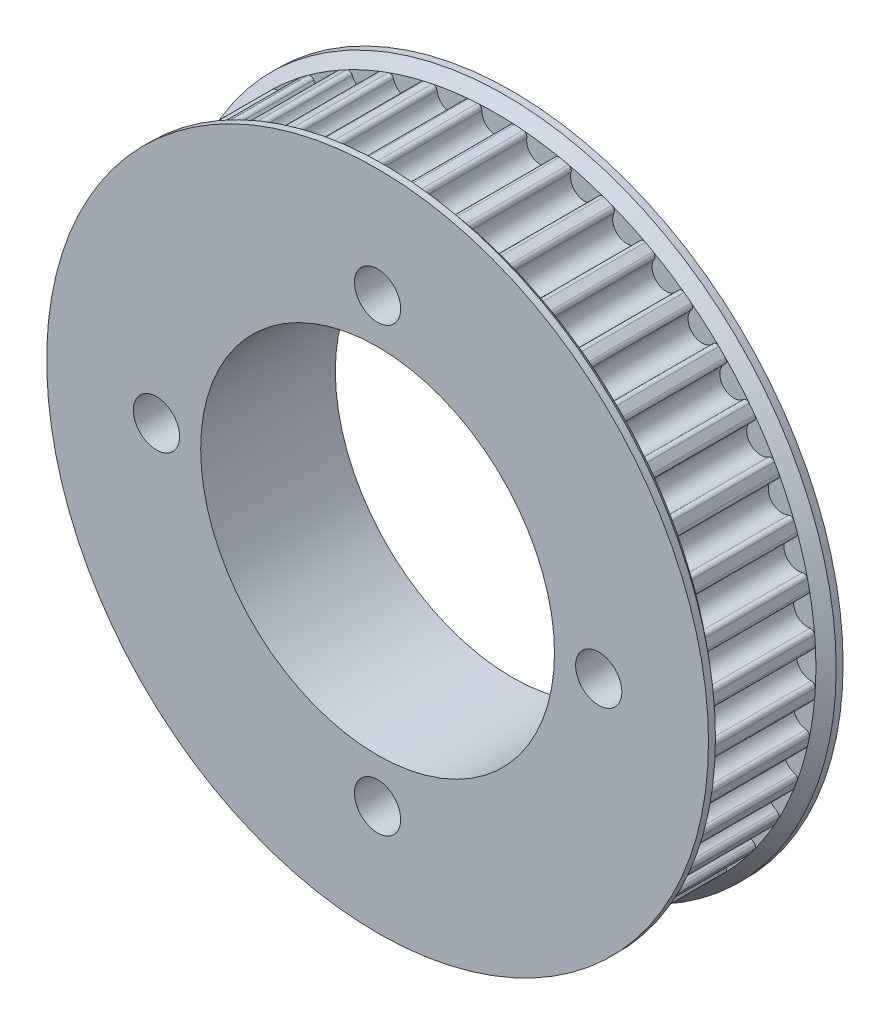
from build123d import *

# Parameters (mm, degrees)
CROQUIS2_R                 = 34.44258748
SALIENTE_EXTRUIR1_DEPTH    = 5.5
CORTAR_EXTRUIR2_DEPTH      = 50.018707293
MATRIZC4_COUNT             = 44
CORTAR_EXTRUIR3_DEPTH      = 51.913407148
CORTAR_EXTRUIR3_DEPTH_BACK = 51.913407148
CROQUIS7_R                 = 19.05
CROQUIS7_R_2               = 2.4892
CORTAR_EXTRUIR4_DEPTH      = 14.5


with BuildPart() as part:
    # Croquis2 → Saliente-Extruir1 (new, symmetric)
    with BuildSketch(Plane.XY):
        Circle(CROQUIS2_R)
    extrude(amount=SALIENTE_EXTRUIR1_DEPTH, both=True)

    # Croquis4 → Cortar-Extruir2 (cut, symmetric)
    with BuildSketch(Plane.XY):
        with BuildLine():
            ThreePointArc((-1.97909891, 34.385680157), (0, 34.44258748), (1.97909891, 34.385680157))
            ThreePointArc((1.97909891, 34.385680157), (1.655319797, 34.265351065), (1.524524764, 33.945656425))
            ThreePointArc((1.524524764, 33.945656425), (0, 32.38258748), (-1.524524764, 33.945656425))
            ThreePointArc((-1.524524764, 33.945656425), (-1.655319797, 34.265351065), (-1.97909891, 34.385680157))
        make_face()
    cortar_extruir2 = extrude(amount=CORTAR_EXTRUIR2_DEPTH, both=True, mode=Mode.SUBTRACT)

    # MatrizC4: Cortar-Extruir2 ×44 about axis
    matrizc4_axis = Axis((0, 0, 0), (0, 0, 1))
    for i in range(1, MATRIZC4_COUNT):
        add(cortar_extruir2.rotate(matrizc4_axis, i * 360 / MATRIZC4_COUNT), mode=Mode.SUBTRACT)

    # Croquis5 → Revolución1 (revolve)
    with BuildSketch(Plane(origin=(0, 0, 0), x_dir=(1, 0, 0), z_dir=(0, 1, 0))):
        Polygon((0, 5.5), (34.44258748, 5.5), (35.634341073, 6.5), (35.634341073, 7.25), (0, 7.25), align=None)
        Polygon((0, -7.25), (0, -5.5), (34.44258748, -5.5), (35.634341073, -6.5), (35.634341073, -7.25), align=None)
    revolve(axis=Axis((0, 0, 0), (0, 0, -1)))

    # Croquis6 → Cortar-Extruir3 (cut, two sides: drawn at the far end of the back side and taken through both)
    with BuildSketch(Plane.XY.offset(-CORTAR_EXTRUIR3_DEPTH_BACK)):
        Polygon((2.995350932, -6.3881), (3.688171255, -6.3881), (4.034581416, -5.7881), (7.029932348, -0.6), (7.376342509, 0), (7.029932348, 0.6), (4.034581416, 5.7881), (3.688171255, 6.3881), (2.995350932, 6.3881), (-2.995350932, 6.3881), (-3.688171255, 6.3881), (-4.034581416, 5.7881), (-7.029932348, 0.6), (-7.376342509, 0), (-7.029932348, -0.6), (-4.034581416, -5.7881), (-3.688171255, -6.3881), (-2.995350932, -6.3881), align=None)
        with BuildLine():
            Line((3.688171255, 6.3881), (4.034581416, 5.7881))
            ThreePointArc((4.034581416, 5.7881), (3.980991578, 5.9881), (4.034581416, 6.1881))
            ThreePointArc((4.034581416, 6.1881), (3.888171255, 6.734510162), (3.341761093, 6.5881))
            ThreePointArc((3.341761093, 6.5881), (3.195350932, 6.441689838), (2.995350932, 6.3881))
            Line((2.995350932, 6.3881), (3.688171255, 6.3881))
        make_face()
        with BuildLine():
            Line((-3.688171255, 6.3881), (-2.995350932, 6.3881))
            ThreePointArc((-2.995350932, 6.3881), (-3.195350932, 6.441689838), (-3.341761093, 6.5881))
            ThreePointArc((-3.341761093, 6.5881), (-3.888171255, 6.734510162), (-4.034581416, 6.1881))
            ThreePointArc((-4.034581416, 6.1881), (-3.980991578, 5.9881), (-4.034581416, 5.7881))
            Line((-4.034581416, 5.7881), (-3.688171255, 6.3881))
        make_face()
        with BuildLine():
            ThreePointArc((-7.376342509, -0.4), (-7.176342509, -0.453589838), (-7.029932348, -0.6))
            Line((-7.029932348, -0.6), (-7.376342509, 0))
            Line((-7.376342509, 0), (-7.029932348, 0.6))
            ThreePointArc((-7.029932348, 0.6), (-7.176342509, 0.453589838), (-7.376342509, 0.4))
            ThreePointArc((-7.376342509, 0.4), (-7.776342509, 0), (-7.376342509, -0.4))
        make_face()
        with BuildLine():
            ThreePointArc((-3.341761093, -6.5881), (-3.195350932, -6.441689838), (-2.995350932, -6.3881))
            Line((-2.995350932, -6.3881), (-3.688171255, -6.3881))
            Line((-3.688171255, -6.3881), (-4.034581416, -5.7881))
            ThreePointArc((-4.034581416, -5.7881), (-3.980991578, -5.9881), (-4.034581416, -6.1881))
            ThreePointArc((-4.034581416, -6.1881), (-3.888171255, -6.734510162), (-3.341761093, -6.5881))
        make_face()
        with BuildLine():
            Line((4.034581416, -5.7881), (3.688171255, -6.3881))
            Line((3.688171255, -6.3881), (2.995350932, -6.3881))
            ThreePointArc((2.995350932, -6.3881), (3.195350932, -6.441689838), (3.341761093, -6.5881))
            ThreePointArc((3.341761093, -6.5881), (3.888171255, -6.734510162), (4.034581416, -6.1881))
            ThreePointArc((4.034581416, -6.1881), (3.980991578, -5.9881), (4.034581416, -5.7881))
        make_face()
        with BuildLine():
            Line((7.376342509, 0), (7.029932348, -0.6))
            ThreePointArc((7.029932348, -0.6), (7.176342509, -0.453589838), (7.376342509, -0.4))
            ThreePointArc((7.376342509, -0.4), (7.776342509, 0), (7.376342509, 0.4))
            ThreePointArc((7.376342509, 0.4), (7.176342509, 0.453589838), (7.029932348, 0.6))
            Line((7.029932348, 0.6), (7.376342509, 0))
        make_face()
    extrude(amount=CORTAR_EXTRUIR3_DEPTH + CORTAR_EXTRUIR3_DEPTH_BACK, mode=Mode.SUBTRACT)

    # Croquis7 → Cortar-Extruir4 (cut)
    with BuildSketch(Plane.XY.offset(7.25)):
        Circle(CROQUIS7_R)
        with Locations((-23.8125, 0)):
            Circle(CROQUIS7_R_2)
        with Locations((0, 23.8125)):
            Circle(CROQUIS7_R_2)
        with Locations((0, -23.8125)):
            Circle(CROQUIS7_R_2)
        with Locations((23.8125, 0)):
            Circle(CROQUIS7_R_2)
    extrude(amount=-CORTAR_EXTRUIR4_DEPTH, mode=Mode.SUBTRACT)


solid = part.part
